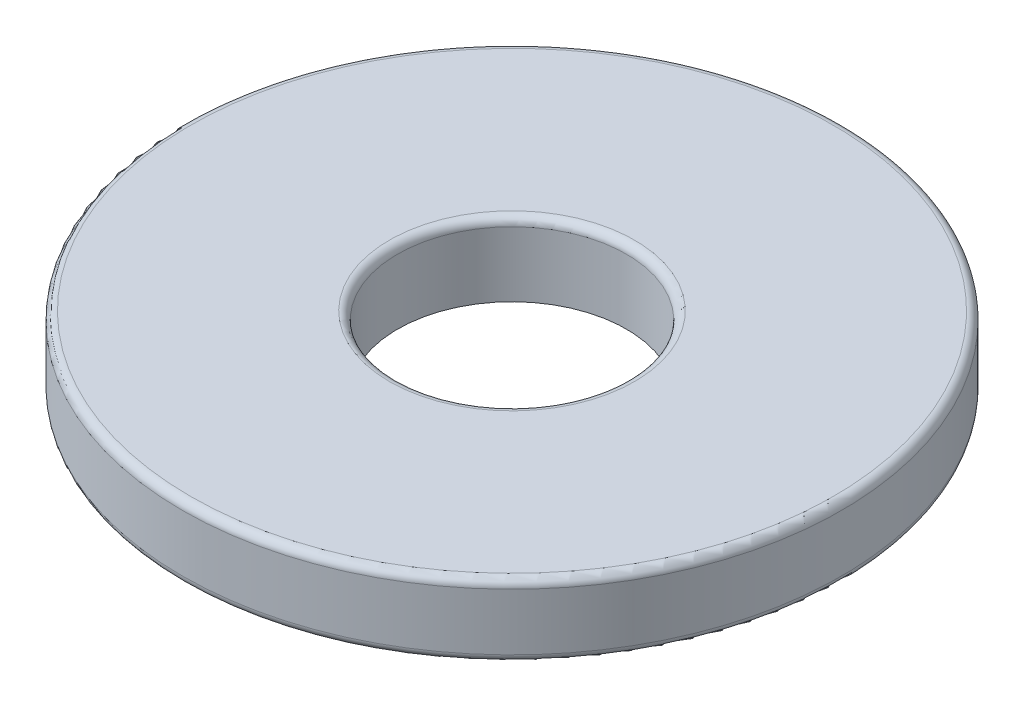
from build123d import *

# Parameters (mm, degrees)
SKETCH1_R           = 5.1562
SKETCH1_R_2         = 1.7907
BOSS_EXTRUDE1_DEPTH = 1.143
FILLET1_R           = 0.127


with BuildPart() as part:
    # Sketch1 → Boss-Extrude1 (new body)
    with BuildSketch(Plane(origin=(0, 0, 0), x_dir=(1, 0, 0), z_dir=(0, 1, 0))):
        with Locations(Location((0, 0, 0), (0, 0, 270))):
            Circle(SKETCH1_R)
        with Locations(Location((0, 0, 0), (0, 0, 270))):
            Circle(SKETCH1_R_2, mode=Mode.SUBTRACT)
    extrude(amount=BOSS_EXTRUDE1_DEPTH)

    # Fillet1
    fillet1_edges = [part.edges().sort_by_distance(p)[0] for p in [
        (0, 0, -5.1562),
        (0, 1.143, -5.1562),
        (0, 1.143, -1.7907),
    ]]
    fillet(fillet1_edges, radius=FILLET1_R)


solid = part.part
